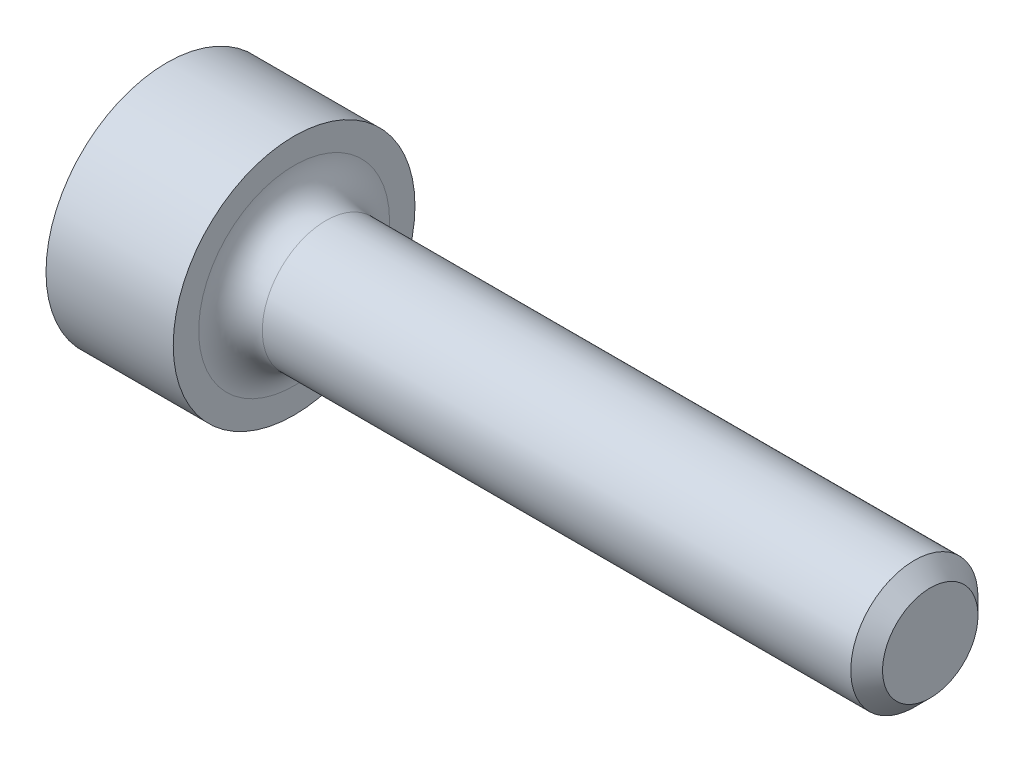
from build123d import *

# Parameters (mm, degrees)
FILLET_1_R          = 0.5
CUT_EXTRUDE_2_DEPTH = 1
CHAMFER_3_SIZE      = 0.25


with BuildPart() as part:
    # Эскиз2 → Повернуть1 (revolve)
    with BuildSketch(Plane.XY, mode=Mode.PRIVATE) as revolve_1_sk:
        Polygon((0, 0), (0, -1.9), (2, -1.9), (2, -1), (12, -1), (12, 0), align=None)
    revolve(revolve_1_sk.sketch.rotate(Axis((0, 0, 0), (1, 0, 0)), 270), axis=Axis((0, 0, 0), (1, 0, 0)))

    # Скругление1
    fillet_1_edges = [part.edges().sort_by_distance(p)[0] for p in [
        (2, 0, -1),
    ]]
    fillet(fillet_1_edges, radius=FILLET_1_R)

    # Эскиз3 → Вырез-Вытянуть2 (cut)
    with BuildSketch(Plane.ZY):
        Polygon((0, 0.866025404), (-0.75, 0.433012702), (-0.75, -0.433012702), (0, -0.866025404), (0.75, -0.433012702), (0.75, 0.433012702), align=None)
    extrude(amount=-CUT_EXTRUDE_2_DEPTH, mode=Mode.SUBTRACT)

    # Эскиз5 → Вырез-Повернуть1 (revolve, cut)
    with BuildSketch(Plane.XY, mode=Mode.PRIVATE) as cut_revolve_1_sk:
        Polygon((1, -0.866025404), (1, 0), (1.5, 0), align=None)
    revolve(cut_revolve_1_sk.sketch.rotate(Axis((1, 0, 0), (1, 0, 0)), 90), axis=Axis((1, 0, 0), (1, 0, 0)), mode=Mode.SUBTRACT)

    # Фаска3
    chamfer_3_edges = [part.edges().sort_by_distance(p)[0] for p in [
        (12, 0, -1),
    ]]
    chamfer(chamfer_3_edges, length=CHAMFER_3_SIZE)


solid = part.part
